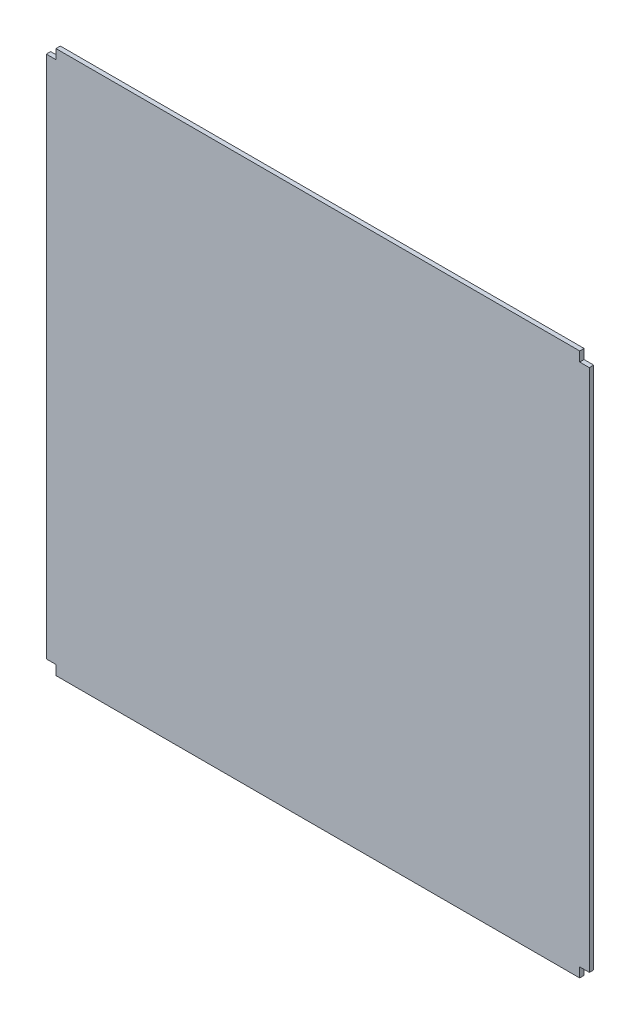
from build123d import *

# Parameters (mm, degrees)
BOSS_EXTRU_1_DEPTH = 5


with BuildPart() as part:
    # Esquisse1 → Boss.-Extru.1 (new body)
    with BuildSketch(Plane.XY):
        Polygon((299, 310), (-299, 310), (-299, 299), (-310, 299), (-310, -299), (-299, -299), (-299, -310), (299, -310), (299, -299), (310, -299), (310, 299), (299, 299), align=None)
    extrude(amount=BOSS_EXTRU_1_DEPTH)


solid = part.part
